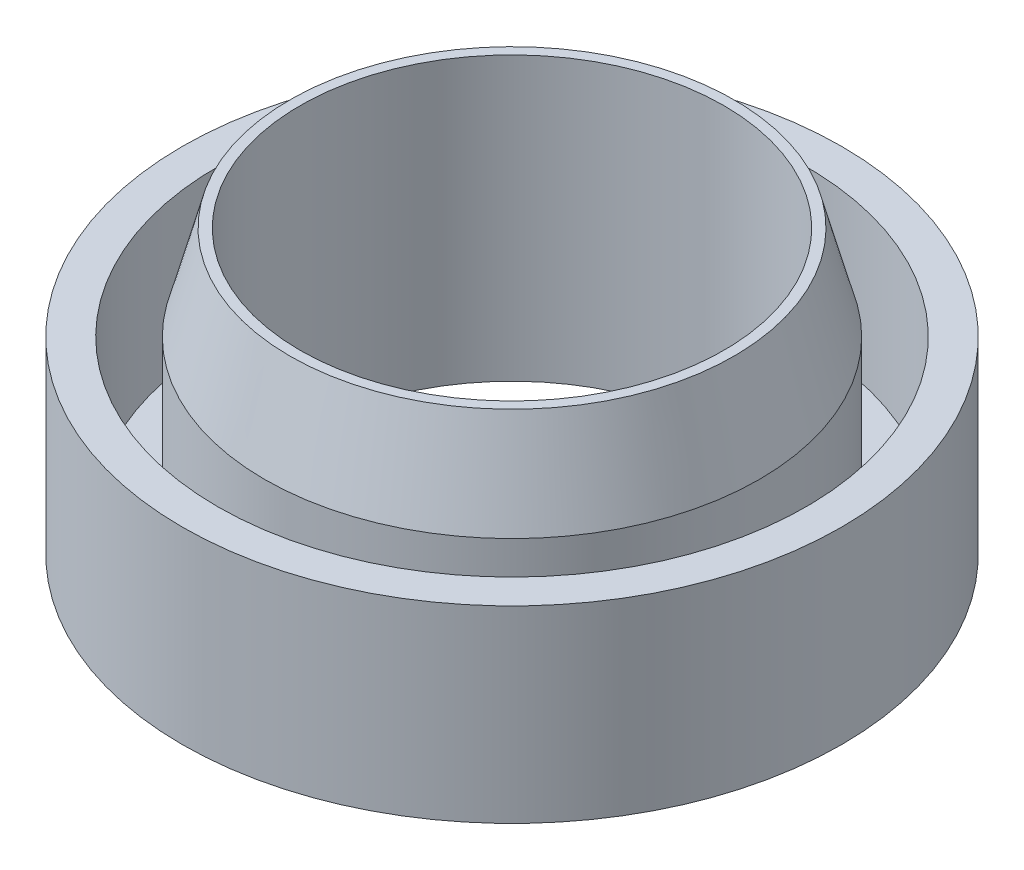
from build123d import *

# Parameters (mm, degrees)
SKETCH1_R           = 14
BOSS_EXTRUDE1_DEPTH = 12
CUT_EXTRUDE1_REACH  = 25.152
SKETCH2_R           = 9
SKETCH3_R           = 12.5
SKETCH3_R_2         = 10.5
CUT_EXTRUDE2_DEPTH  = 10.5
SKETCH4_R           = 14
SKETCH4_R_2         = 12.5
CUT_EXTRUDE3_DEPTH  = 4
CHAMFER1_SIZE       = 4
CHAMFER1_SIZE2      = 1.07179677


with BuildPart() as part:
    # Sketch1 → Boss-Extrude1 (new body)
    with BuildSketch(Plane(origin=(0, 0, 0), x_dir=(1, 0, 0), z_dir=(0, 1, 0))):
        with Locations(Location((0, 0, 0), (0, 0, 270))):
            Circle(SKETCH1_R)
    extrude(amount=BOSS_EXTRUDE1_DEPTH)

    # Sketch2 → Cut-Extrude1 (cut, up to next)
    with BuildSketch(Plane(origin=(0, 12, 0), x_dir=(1, 0, 0), z_dir=(0, 1, 0)), mode=Mode.PRIVATE) as cut_extrude1_sk1:
        with Locations(Location((0, 0, 0), (0, 0, 270))):
            Circle(SKETCH2_R)
    cut_extrude1_tool1 = extrude(cut_extrude1_sk1.sketch, amount=-CUT_EXTRUDE1_REACH, mode=Mode.PRIVATE) & part.part
    add(cut_extrude1_tool1.solids().sort_by_distance((0, 12, 0))[0], mode=Mode.SUBTRACT)

    # Sketch3 → Cut-Extrude2 (cut)
    with BuildSketch(Plane(origin=(0, 12, 0), x_dir=(1, 0, 0), z_dir=(0, 1, 0))):
        with Locations(Location((0, 0, 0), (0, 0, 270))):
            Circle(SKETCH3_R)
        with Locations(Location((0, 0, 0), (0, 0, 270))):
            Circle(SKETCH3_R_2, mode=Mode.SUBTRACT)
    extrude(amount=-CUT_EXTRUDE2_DEPTH, mode=Mode.SUBTRACT)

    # Sketch4 → Cut-Extrude3 (cut)
    with BuildSketch(Plane(origin=(0, 12, 0), x_dir=(1, 0, 0), z_dir=(0, 1, 0))):
        with Locations(Location((0, 0, 0), (0, 0, 270))):
            Circle(SKETCH4_R)
        with Locations(Location((0, 0, 0), (0, 0, 270))):
            Circle(SKETCH4_R_2, mode=Mode.SUBTRACT)
    extrude(amount=-CUT_EXTRUDE3_DEPTH, mode=Mode.SUBTRACT)

    # Chamfer1
    chamfer1_edges = [part.edges().sort_by_distance(p)[0] for p in [
        (0, 12, -10.5),
    ]]
    chamfer1_side = [part.faces().sort_by_distance(p)[0] for p in [
        (0, 6.75, -10.5),
    ]]
    chamfer(chamfer1_edges, length=CHAMFER1_SIZE, length2=CHAMFER1_SIZE2, reference=chamfer1_side[0])


solid = part.part
